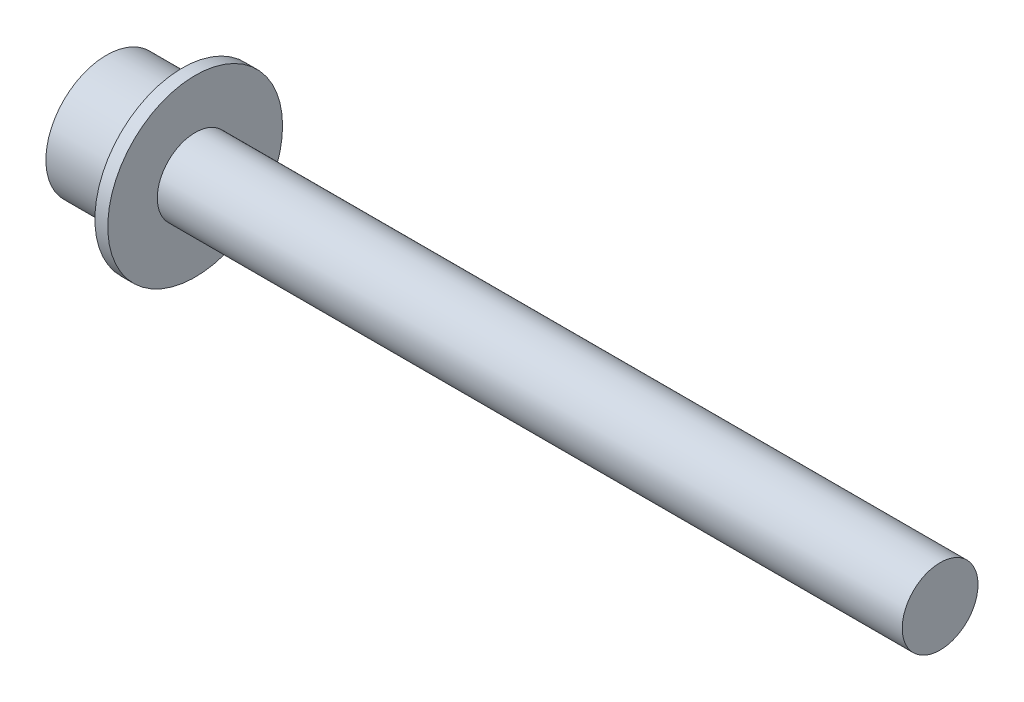
from build123d import *

# Parameters (mm, degrees)
SKETCH1_R           = 2.4
BOSS_EXTRUDE1_DEPTH = 3
SKETCH2_R           = 1.5
BOSS_EXTRUDE2_DEPTH = 30
SKETCH3_R           = 3.46
BOSS_EXTRUDE3_DEPTH = 0.51


with BuildPart() as part:
    # Sketch1 → Boss-Extrude1 (new body)
    with BuildSketch(Plane(origin=(0, 0, 0), x_dir=(0, 0, -1), z_dir=(1, 0, 0))):
        Circle(SKETCH1_R)
    extrude(amount=BOSS_EXTRUDE1_DEPTH)

    # Sketch2 → Boss-Extrude2 (add)
    with BuildSketch(Plane(origin=(3, 0, 0), x_dir=(0, 0, -1), z_dir=(1, 0, 0))):
        Circle(SKETCH2_R)
    extrude(amount=BOSS_EXTRUDE2_DEPTH)

    # Sketch3 → Boss-Extrude3 (add)
    with BuildSketch(Plane(origin=(3, 0, 0), x_dir=(0, 0, -1), z_dir=(1, 0, 0))):
        Circle(SKETCH3_R)
    extrude(amount=BOSS_EXTRUDE3_DEPTH)


solid = part.part
